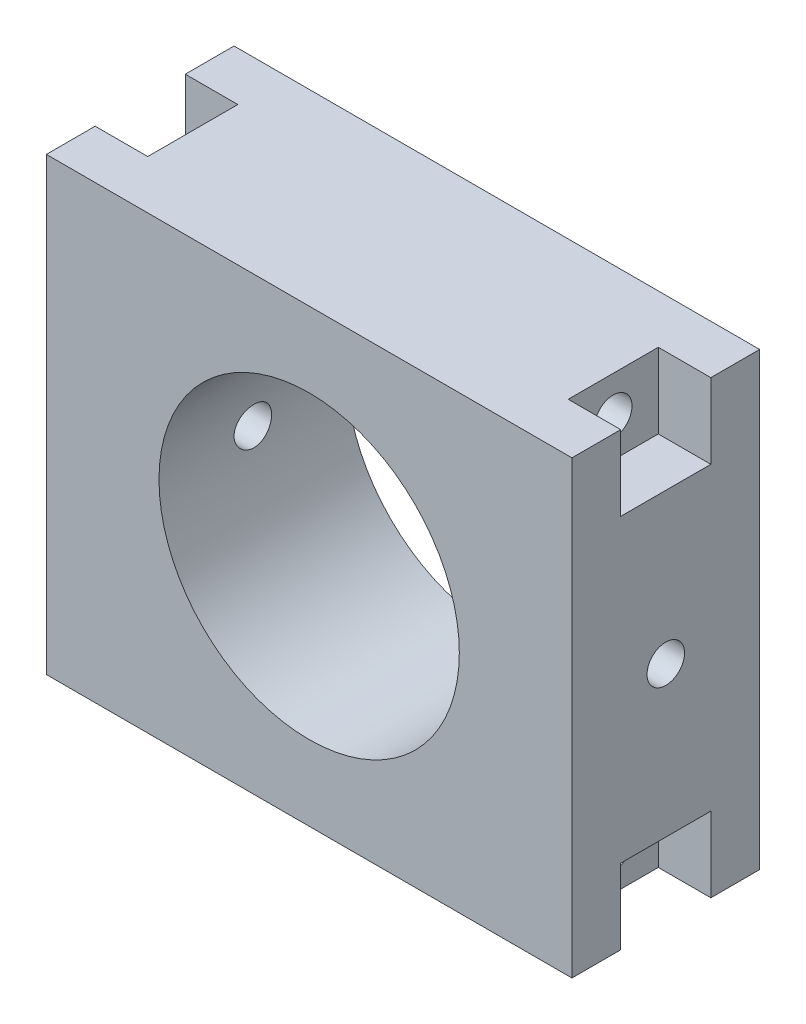
from build123d import *

# Parameters (mm, degrees)
SKETCH1_W           = 70
SKETCH1_H           = 60
SKETCH1_R           = 20
BOSS_EXTRUDE1_DEPTH = 25
SKETCH2_R           = 2.5
CUT_EXTRUDE1_DEPTH  = 81.156097709
SKETCH3_W           = 7
SKETCH3_H           = 12
CUT_EXTRUDE2_DEPTH  = 10


with BuildPart() as part:
    # Sketch1 → Boss-Extrude1 (new body)
    with BuildSketch(Plane.XY):
        Rectangle(SKETCH1_W, SKETCH1_H)
        Circle(SKETCH1_R, mode=Mode.SUBTRACT)
    extrude(amount=BOSS_EXTRUDE1_DEPTH)

    # Sketch2 → Cut-Extrude1 (cut, through all)
    with BuildSketch(Plane(origin=(35, 0, 0), x_dir=(0, 0, -1), z_dir=(1, 0, 0))):
        with Locations((-12.5, 25)):
            Circle(SKETCH2_R)
        with Locations((-12.5, -25)):
            Circle(SKETCH2_R)
        with Locations((-12.5, 0)):
            Circle(SKETCH2_R)
    extrude(amount=-CUT_EXTRUDE1_DEPTH, mode=Mode.SUBTRACT)

    # Sketch3 → Cut-Extrude2 (cut)
    with BuildSketch(Plane(origin=(0, 30, 0), x_dir=(1, 0, 0), z_dir=(0, 1, 0))):
        Polygon((-28, -6.5), (-35, -6.5), (-35, -18.5), (-28, -18.5), (-28, -15), (-28, -10), align=None)
        with Locations((31.5, -12.5)):
            Rectangle(SKETCH3_W, SKETCH3_H)
    cut_extrude2 = extrude(amount=-CUT_EXTRUDE2_DEPTH, mode=Mode.SUBTRACT)

    # Mirror1: Cut-Extrude2 across plane
    add(cut_extrude2.mirror(Plane.ZX), mode=Mode.SUBTRACT)


solid = part.part
